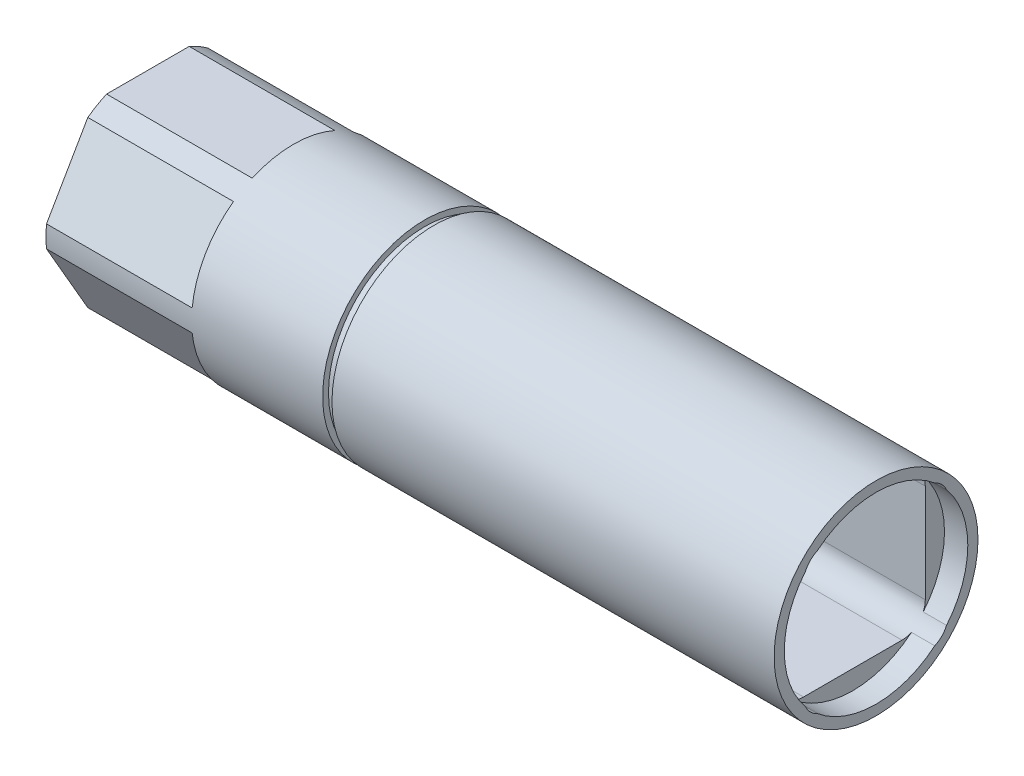
from build123d import *

# Parameters (mm, degrees)
SKETCH1_W                  = 125
SKETCH1_H                  = 17.5
SKETCH3_R                  = 15.75
CUT_EXTRUDE1_DEPTH         = 4
CUT_EXTRUDE2_DEPTH         = 25
CUT_EXTRUDE2_DEPTH_BACK    = 25
SKETCH5_OUTSIDE_W          = 63.888
SKETCH5_OUTSIDE_H          = 63.888
CUT_EXTRUDE3_DEPTH         = 25
SKETCH6_W                  = 1.6
SKETCH6_H                  = 12.966966859
M10X1_5_TAPPED_HOLE1_D     = 8.5
M10X1_5_TAPPED_HOLE1_DEPTH = 24.5
M10X1_5_TAPPED_HOLE1_TIP   = 2.553657631


with BuildPart() as part:
    # Sketch1 → Revolve1 (revolve)
    with BuildSketch(Plane.XY, mode=Mode.PRIVATE) as revolve1_sk:
        with Locations((62.5, 8.75)):
            Rectangle(SKETCH1_W, SKETCH1_H)
    revolve(revolve1_sk.sketch.rotate(Axis((0, 0, 0), (-1, 0, 0)), 90), axis=Axis((0, 0, 0), (-1, 0, 0)))

    # Sketch3 → Cut-Extrude1 (cut)
    with BuildSketch(Plane(origin=(125, 0, 0), x_dir=(0, 0, -1), z_dir=(1, 0, 0))):
        Circle(SKETCH3_R)
    extrude(amount=-CUT_EXTRUDE1_DEPTH, mode=Mode.SUBTRACT)

    # Sketch4 → Cut-Extrude2 (cut, two sides: drawn at the far end of the back side and taken through both)
    with BuildSketch(Plane(origin=(121, 0, 0), x_dir=(0, 0, -1), z_dir=(1, 0, 0)).offset(-CUT_EXTRUDE2_DEPTH_BACK)):
        with BuildLine():
            Line((-8.45, 12.45), (8.45, 12.45))
            ThreePointArc((8.45, 12.45), (11.278427125, 11.278427125), (12.45, 8.45))
            Line((12.45, 8.45), (12.45, -8.45))
            ThreePointArc((12.45, -8.45), (11.278427125, -11.278427125), (8.45, -12.45))
            Line((8.45, -12.45), (-8.45, -12.45))
            ThreePointArc((-8.45, -12.45), (-11.278427125, -11.278427125), (-12.45, -8.45))
            Line((-12.45, -8.45), (-12.45, 8.45))
            ThreePointArc((-12.45, 8.45), (-11.278427125, 11.278427125), (-8.45, 12.45))
        make_face()
    extrude(amount=CUT_EXTRUDE2_DEPTH + CUT_EXTRUDE2_DEPTH_BACK, mode=Mode.SUBTRACT)

    # Sketch5 outside → Cut-Extrude3 (cut)
    with BuildSketch(Plane.ZY):
        Rectangle(SKETCH5_OUTSIDE_W, SKETCH5_OUTSIDE_H)
        Polygon((9.237604307, 16), (-9.237604307, 16), (-18.475208614, 0), (-9.237604307, -16), (9.237604307, -16), (18.475208614, 0), align=None, mode=Mode.SUBTRACT)
    extrude(amount=-CUT_EXTRUDE3_DEPTH, mode=Mode.SUBTRACT)

    # Sketch6 → Cut-Revolve1 (revolve, cut)
    with BuildSketch(Plane(origin=(0, 0, 0), x_dir=(1, 0, 0), z_dir=(0, 1, 0))):
        with Locations((48.3, 22.98348343)):
            Rectangle(SKETCH6_W, SKETCH6_H)
    revolve(axis=Axis((0, 0, 0), (1, 0, 0)), mode=Mode.SUBTRACT)

    # M10x1.5 Tapped Hole1
    with Locations(Plane.ZY):
        with Locations((0, 0)):
            Hole(M10X1_5_TAPPED_HOLE1_D / 2, depth=M10X1_5_TAPPED_HOLE1_DEPTH)
            with Locations((0, 0, -(M10X1_5_TAPPED_HOLE1_DEPTH + M10X1_5_TAPPED_HOLE1_TIP / 2))):  # 118° drill point
                Cone(0, M10X1_5_TAPPED_HOLE1_D / 2, M10X1_5_TAPPED_HOLE1_TIP, mode=Mode.SUBTRACT)


solid = part.part
